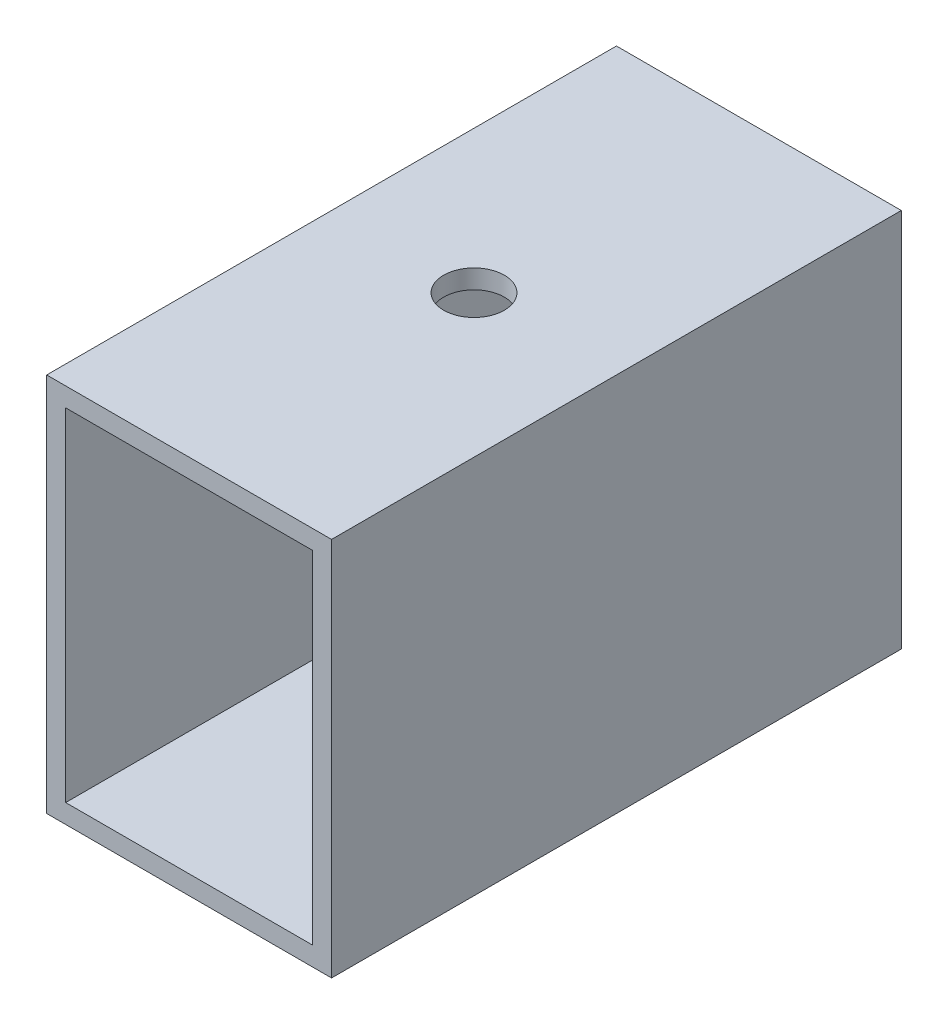
from build123d import *

# Parameters (mm, degrees)
SKETCH_1_W          = 15
SKETCH_1_H          = 20
SKETCH_1_W_2        = 13
SKETCH_1_H_2        = 18
EXTRUDE_1_DEPTH     = 30
SKETCH_3_R          = 1.6
CUT_EXTRUDE_2_DEPTH = 40.05124838


with BuildPart() as part:
    # 草图1 → 拉伸-薄壁1 (new body)
    with BuildSketch(Plane.XY):
        with Locations((7.5, -10)):
            Rectangle(SKETCH_1_W, SKETCH_1_H)
        with Locations((7.5, -10)):
            Rectangle(SKETCH_1_W_2, SKETCH_1_H_2, mode=Mode.SUBTRACT)
    extrude(amount=EXTRUDE_1_DEPTH)

    # 草图3 → 切除-拉伸2 (cut, through all)
    with BuildSketch(Plane.XZ.offset(20)):
        with Locations(Location((7.5, 15, 0), (0, 0, 270))):
            Circle(SKETCH_3_R)
    extrude(amount=-CUT_EXTRUDE_2_DEPTH, mode=Mode.SUBTRACT)


solid = part.part
